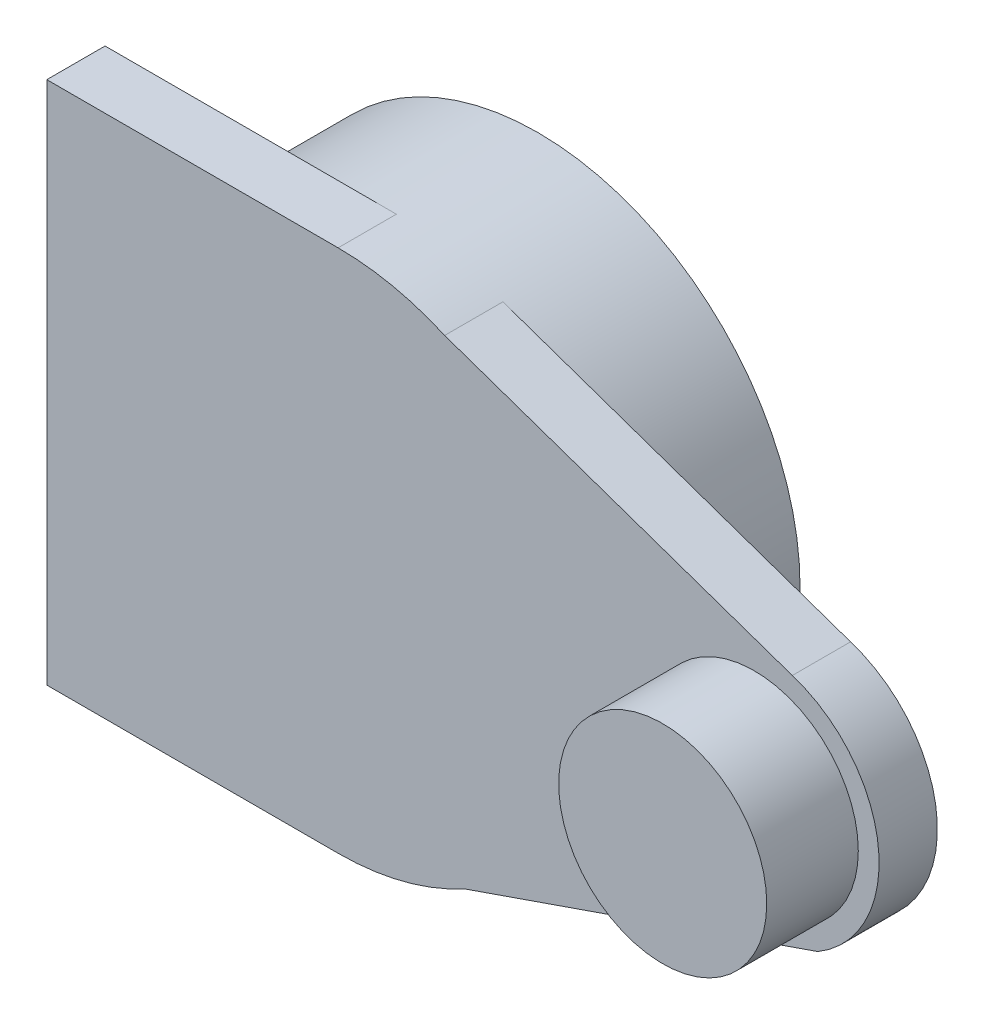
from build123d import *

# Parameters (mm, degrees)
SKETCH1_R           = 31.5
BOSS_EXTRUDE1_DEPTH = 17
SKETCH2_R           = 31.5
BOSS_EXTRUDE2_DEPTH = 7
SKETCH3_R           = 12.5
BOSS_EXTRUDE3_DEPTH = 11


with BuildPart() as part:
    # Sketch1 → Boss-Extrude1 (new body)
    with BuildSketch(Plane.XY):
        Circle(SKETCH1_R)
    extrude(amount=BOSS_EXTRUDE1_DEPTH)

    # Sketch2 → Boss-Extrude2 (add)
    with BuildSketch(Plane.XY.offset(17)):
        with BuildLine():
            Line((0, 31.5), (-35, 31.5))
            Line((-35, 31.5), (-35, -31.5))
            Line((-35, -31.5), (0, -31.5))
            ThreePointArc((0, -31.5), (-31.5, 0), (0, 31.5))
        make_face()
        with Locations(Location((0, 0, 0), (0, 0, 90))):
            Circle(SKETCH2_R)
        with BuildLine():
            Line((35, 21.078091868), (12.801393416, 28.78149278))
            ThreePointArc((12.801393416, 28.78149278), (26.414900081, 17.161091274), (31.5, 0))
            ThreePointArc((31.5, 0), (27.098152806, -16.060514142), (15.122849874, -27.632397864))
            Line((15.122849874, -27.632397864), (57.643936691, -12.906209043))
            ThreePointArc((57.643936691, -12.906209043), (64.905048238, 1.685092584), (54.569602713, 14.28701267))
            Line((54.569602713, 14.28701267), (35, 21.078091868))
        make_face()
    extrude(amount=BOSS_EXTRUDE2_DEPTH)

    # Sketch3 → Boss-Extrude3 (add)
    with BuildSketch(Plane.XY.offset(24)):
        with Locations((50, 0)):
            Circle(SKETCH3_R)
    extrude(amount=BOSS_EXTRUDE3_DEPTH)


solid = part.part
